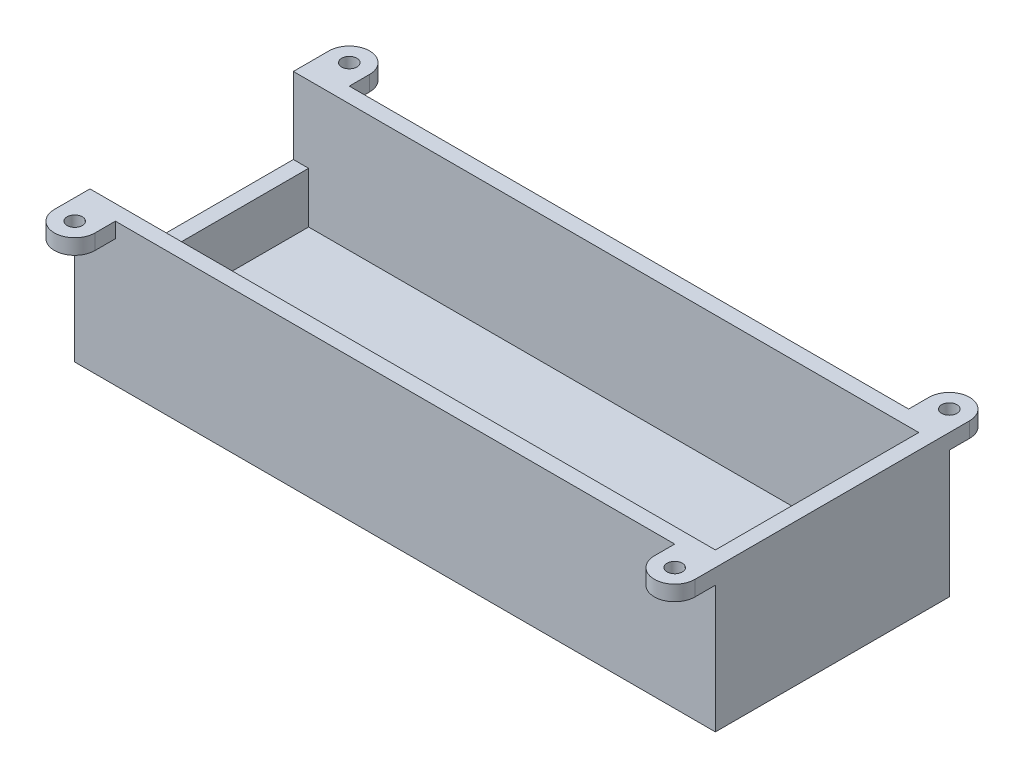
from build123d import *

# Parameters (mm, degrees)
SKETCH1_W      = 126
SKETCH1_H      = 46
EXTRUDE1_DEPTH = 3
SKETCH2_W      = 126
SKETCH2_H      = 46
SKETCH2_W_2    = 120
SKETCH2_H_2    = 40
EXTRUDE2_DEPTH = 25
SKETCH3_R      = 1.5
EXTRUDE3_DEPTH = 3
SKETCH4_W      = 40
SKETCH4_H      = 15
EXTRUDE4_DEPTH = 3


with BuildPart() as part:
    # Sketch1 → Extrude1 (new body)
    with BuildSketch(Plane(origin=(0, 0, 0), x_dir=(1, 0, 0), z_dir=(0, 1, 0))):
        Rectangle(SKETCH1_W, SKETCH1_H)
    extrude(amount=EXTRUDE1_DEPTH)

    # Sketch2 → Extrude2 (add)
    with BuildSketch(Plane(origin=(0, 3, 0), x_dir=(1, 0, 0), z_dir=(0, 1, 0))):
        Rectangle(SKETCH2_W, SKETCH2_H)
        Rectangle(SKETCH2_W_2, SKETCH2_H_2, mode=Mode.SUBTRACT)
    extrude(amount=EXTRUDE2_DEPTH)

    # Sketch3 → Extrude3 (add)
    # profile 1 of 4: a face of its own
    with BuildSketch(Plane(origin=(0, 28, 0), x_dir=(1, 0, 0), z_dir=(0, 1, 0))):
        with BuildLine():
            Line((63, -23), (63, -27))
            ThreePointArc((63, -27), (61.828427125, -29.828427125), (59, -31))
            ThreePointArc((59, -31), (56.171572875, -29.828427125), (55, -27))
            Line((55, -27), (55, -23))
            Line((55, -23), (63, -23))
        make_face()
        with Locations(Location((59, -27, 0), (0, 0, 270))):
            Circle(SKETCH3_R, mode=Mode.SUBTRACT)
    # profile 2 of 4: a face of its own
    with BuildSketch(Plane(origin=(0, 28, 0), x_dir=(1, 0, 0), z_dir=(0, 1, 0))):
        with BuildLine():
            Line((-63, -23), (-55, -23))
            Line((-55, -23), (-55, -27))
            ThreePointArc((-55, -27), (-56.171572875, -29.828427125), (-59, -31))
            ThreePointArc((-59, -31), (-61.828427125, -29.828427125), (-63, -27))
            Line((-63, -27), (-63, -23))
        make_face()
        with Locations(Location((-59, -27, 0), (0, 0, 270))):
            Circle(SKETCH3_R, mode=Mode.SUBTRACT)
    # profile 3 of 4: a face of its own
    with BuildSketch(Plane(origin=(0, 28, 0), x_dir=(1, 0, 0), z_dir=(0, 1, 0))):
        with BuildLine():
            Line((55, 27), (55, 23))
            Line((55, 23), (63, 23))
            Line((63, 23), (63, 27))
            ThreePointArc((63, 27), (61.828427125, 29.828427125), (59, 31))
            ThreePointArc((59, 31), (56.171572875, 29.828427125), (55, 27))
        make_face()
        with Locations(Location((59, 27, 0), (0, 0, 90))):
            Circle(SKETCH3_R, mode=Mode.SUBTRACT)
    # profile 4 of 4: a face of its own
    with BuildSketch(Plane(origin=(0, 28, 0), x_dir=(1, 0, 0), z_dir=(0, 1, 0))):
        with BuildLine():
            Line((-55, 27), (-55, 23))
            Line((-55, 23), (-63, 23))
            Line((-63, 23), (-63, 27))
            ThreePointArc((-63, 27), (-61.828427125, 29.828427125), (-59, 31))
            ThreePointArc((-59, 31), (-56.171572875, 29.828427125), (-55, 27))
        make_face()
        with Locations(Location((-59, 27, 0), (0, 0, 90))):
            Circle(SKETCH3_R, mode=Mode.SUBTRACT)
    extrude(amount=-EXTRUDE3_DEPTH)

    # Sketch4 → Extrude4 (cut)
    with BuildSketch(Plane(origin=(-60, 0, 0), x_dir=(0, 0, -1), z_dir=(1, 0, 0))):
        with Locations((0, 20.5)):
            Rectangle(SKETCH4_W, SKETCH4_H)
    extrude(amount=-EXTRUDE4_DEPTH, mode=Mode.SUBTRACT)


solid = part.part
